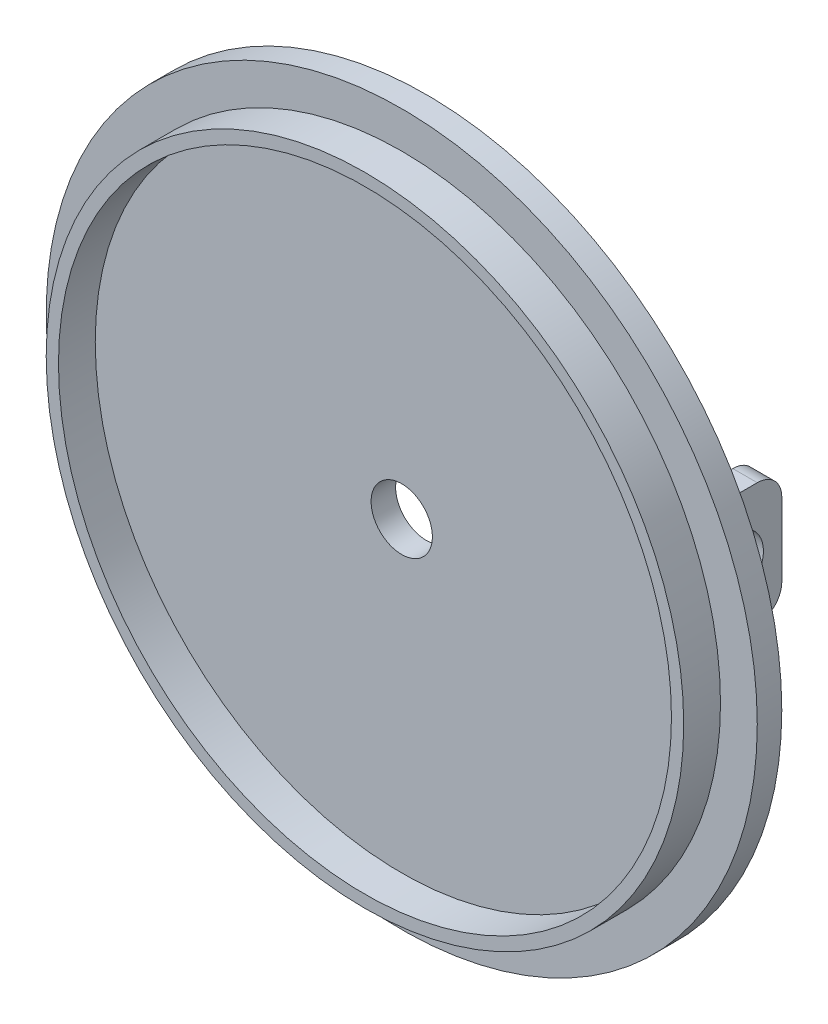
from build123d import *

# Parameters (mm, degrees)
SKETCH1_R           = 29
SKETCH1_R_2         = 2.5
BOSS_EXTRUDE1_DEPTH = 2
SKETCH2_R           = 26
SKETCH2_R_2         = 25
BOSS_EXTRUDE2_DEPTH = 3
BOSS_EXTRUDE3_DEPTH = 2
SKETCH4_W           = 2
SKETCH4_H           = 10
BOSS_EXTRUDE4_DEPTH = 10
FILLET1_R           = 2
SKETCH5_R           = 2.5
CUT_EXTRUDE1_DEPTH  = 56.686623169


with BuildPart() as part:
    # Sketch1 → Boss-Extrude1 (new body)
    with BuildSketch(Plane.XY):
        Circle(SKETCH1_R)
        Circle(SKETCH1_R_2, mode=Mode.SUBTRACT)
    extrude(amount=BOSS_EXTRUDE1_DEPTH)

    # Sketch2 → Boss-Extrude2 (add)
    with BuildSketch(Plane.XY.offset(2)):
        Circle(SKETCH2_R)
        Circle(SKETCH2_R_2, mode=Mode.SUBTRACT)
    extrude(amount=BOSS_EXTRUDE2_DEPTH)

    # Sketch3 → Boss-Extrude3 (add)
    with BuildSketch(Plane(origin=(0, 0, 0), x_dir=(-1, 0, 0), z_dir=(0, 0, -1))):
        with BuildLine():
            Line((-13.75, 7.5), (-13.75, -7.5))
            ThreePointArc((-13.75, -7.5), (-16, -9.75), (-18.25, -7.5))
            Line((-18.25, -7.5), (-18.25, 7.5))
            ThreePointArc((-18.25, 7.5), (-16, 9.75), (-13.75, 7.5))
        make_face()
        with BuildLine():
            Line((18.25, 7.5), (18.25, -7.5))
            ThreePointArc((18.25, -7.5), (16, -9.75), (13.75, -7.5))
            Line((13.75, -7.5), (13.75, 7.5))
            ThreePointArc((13.75, 7.5), (16, 9.75), (18.25, 7.5))
        make_face()
    extrude(amount=BOSS_EXTRUDE3_DEPTH)

    # Sketch4 → Boss-Extrude4 (add)
    with BuildSketch(Plane(origin=(0, 0, -2), x_dir=(-1, 0, 0), z_dir=(0, 0, -1))):
        with Locations((-16, 0.07539605)):
            Rectangle(SKETCH4_W, SKETCH4_H)
        with Locations((16, 0.07539605)):
            Rectangle(SKETCH4_W, SKETCH4_H)
    extrude(amount=BOSS_EXTRUDE4_DEPTH)

    # Fillet1
    fillet1_edges = [part.edges().sort_by_distance(p)[0] for p in [
        (16, 5.07539605, -12),
        (16, -4.92460395, -12),
        (-16, 5.07539605, -12),
        (-16, -4.92460395, -12),
    ]]
    fillet(fillet1_edges, radius=FILLET1_R)

    # Sketch5 → Cut-Extrude1 (cut, through all)
    with BuildSketch(Plane.ZY.offset(17)):
        with Locations(Location((-8, 0, 0), (0, 0, 270))):
            Circle(SKETCH5_R)
    extrude(amount=-CUT_EXTRUDE1_DEPTH, mode=Mode.SUBTRACT)


solid = part.part
